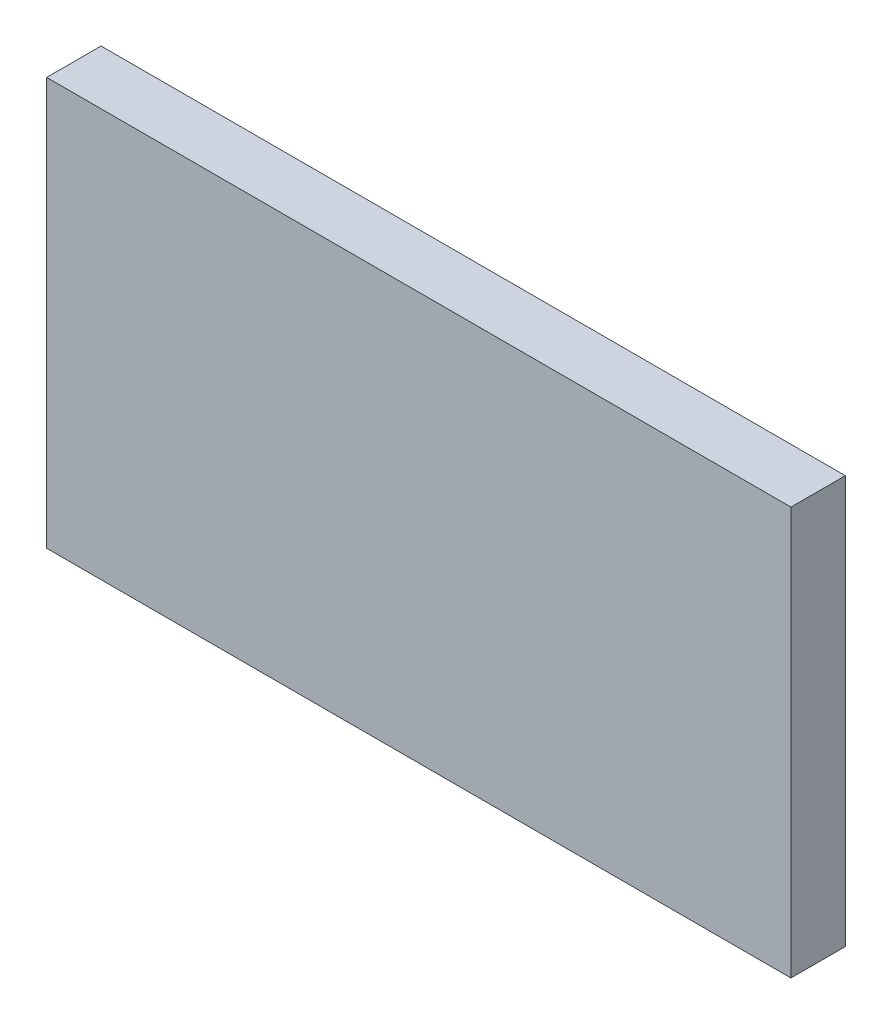
from build123d import *

# Parameters (mm, degrees)
CURVESKETCH_W   = 31.719
CURVESKETCH_H   = 17.381
CURVEBOSS_DEPTH = 2.317


with BuildPart() as part:
    # CurveSketch → CurveBoss (new body)
    with BuildSketch(Plane.XY):
        with Locations((-4.193, 6.827)):
            Rectangle(CURVESKETCH_W, CURVESKETCH_H)
    extrude(amount=-CURVEBOSS_DEPTH)


solid = part.part
